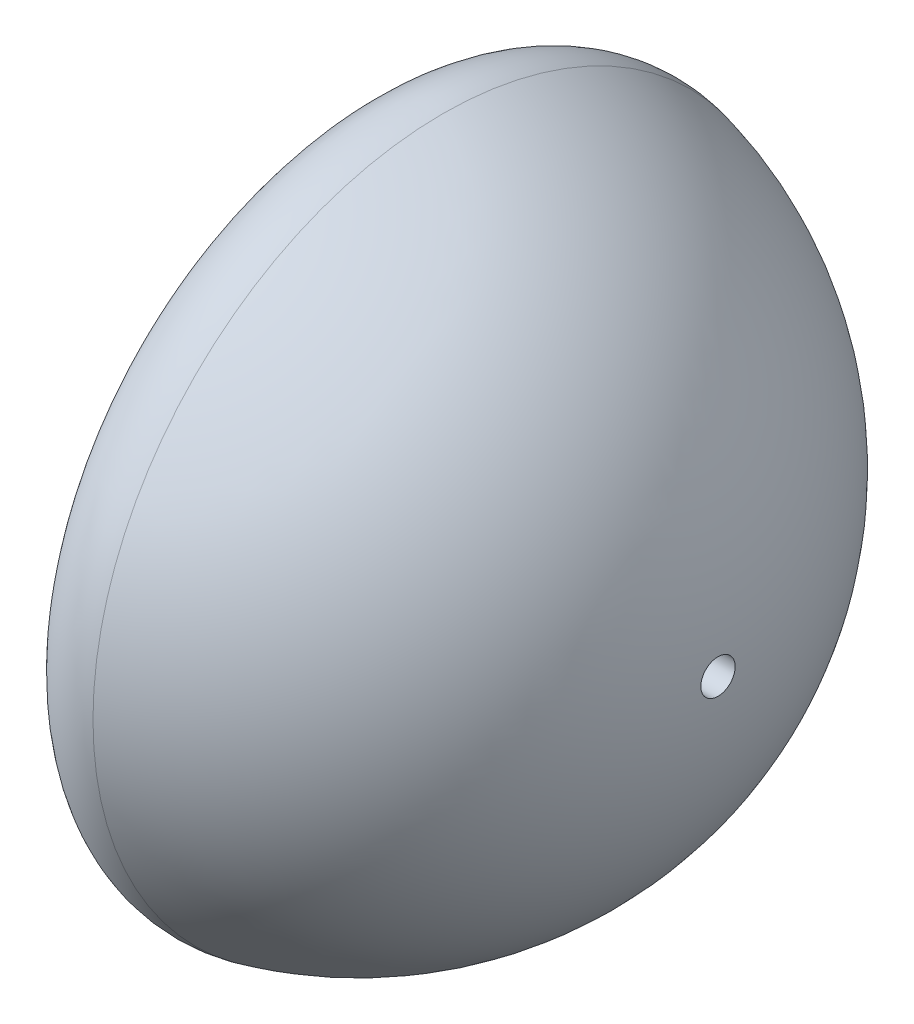
from build123d import *

# Parameters (mm, degrees)
FILLET1_R = 10


with BuildPart() as part:
    # Sketch1 → Revolve1 (revolve)
    with BuildSketch(Plane.XY):
        with BuildLine():
            Line((-66.458013888, 2.499885579), (-118.898519413, 2.499885579))
            Line((-118.898519413, 2.499885579), (-118.898519413, 52.499885579))
            ThreePointArc((-118.898519413, 52.499885579), (-82.670054707, 37.996599453), (-66.458013888, 2.499885579))
        make_face()
    revolve(axis=Axis((-111.398519413, -0.000180618, 0), (-1, 0, 0)))

    # Fillet1
    fillet1_edges = [part.edges().sort_by_distance(p)[0] for p in [
        (-118.898519413, -52.500246814, 0),
    ]]
    fillet(fillet1_edges, radius=FILLET1_R)


solid = part.part
